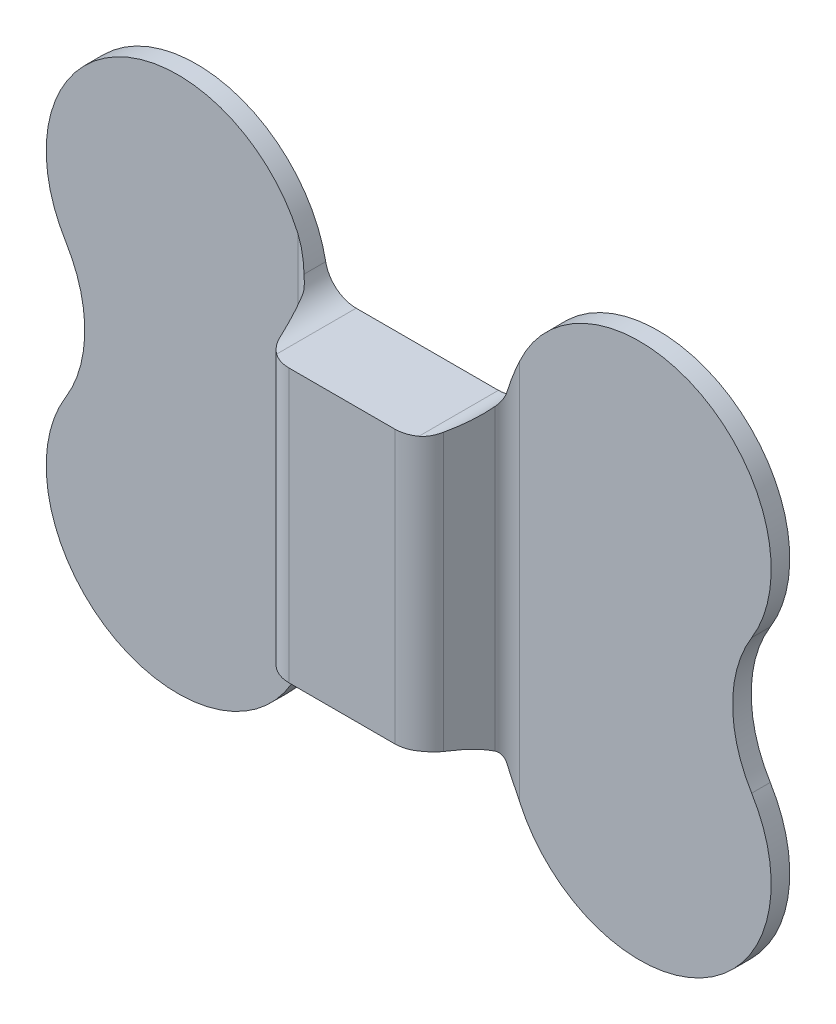
from build123d import *

# Parameters (mm, degrees)
BOSS_EXTRUDE1_DEPTH     = 27.56
CUT_EXTRUDE1_DEPTH      = 149.090525018
CUT_EXTRUDE1_DEPTH_BACK = 149.090525018


with BuildPart() as part:
    # Sketch1 → Boss-Extrude1 (new body)
    with BuildSketch(Plane.XY):
        with BuildLine():
            Line((22.96117968, 44), (-22.96117968, 44))
            ThreePointArc((-22.96117968, 44), (-29.323269783, 46.284832502), (-32.778097836, 52.095238095))
            ThreePointArc((-32.778097836, 52.095238095), (-89.927364847, 83.601091069), (-110.70300535, 21.738095238))
            ThreePointArc((-110.70300535, 21.738095238), (-104.55417528, 0), (-110.70300535, -21.738095238))
            ThreePointArc((-110.70300535, -21.738095238), (-89.927364847, -83.601091069), (-32.778097836, -52.095238095))
            ThreePointArc((-32.778097836, -52.095238095), (-29.323269783, -46.284832502), (-22.96117968, -44))
            Line((-22.96117968, -44), (22.96117968, -44))
            ThreePointArc((22.96117968, -44), (29.323269783, -46.284832502), (32.778097836, -52.095238095))
            ThreePointArc((32.778097836, -52.095238095), (89.927364847, -83.601091069), (110.70300535, -21.738095238))
            ThreePointArc((110.70300535, -21.738095238), (104.55417528, 0), (110.70300535, 21.738095238))
            ThreePointArc((110.70300535, 21.738095238), (89.927364847, 83.601091069), (32.778097836, 52.095238095))
            ThreePointArc((32.778097836, 52.095238095), (29.323269783, 46.284832502), (22.96117968, 44))
        make_face()
    extrude(amount=BOSS_EXTRUDE1_DEPTH)

    # Sketch2 → Cut-Extrude1 (cut, two sides: drawn at the far end of the back side and taken through both)
    with BuildSketch(Plane(origin=(0, 0, 0), x_dir=(1, 0, 0), z_dir=(0, 1, 0)).offset(-CUT_EXTRUDE1_DEPTH_BACK)):
        with BuildLine():
            Line((117, -6), (35.767564174, -6))
            ThreePointArc((35.767564174, -6), (32.945610035, -6.872461407), (31.108474327, -9.185370066))
            Line((31.108474327, -9.185370066), (26.433179694, -21.189259868))
            ThreePointArc((26.433179694, -21.189259868), (22.758908279, -25.815077185), (17.115, -27.56))
            Line((17.115, -27.56), (117, -27.56))
            Line((117, -27.56), (117, -6))
        make_face()
        with BuildLine():
            Line((-117, -27.56), (-117, -6))
            Line((-117, -6), (-35.767564174, -6))
            ThreePointArc((-35.767564174, -6), (-32.945610035, -6.872461407), (-31.108474327, -9.185370066))
            Line((-31.108474327, -9.185370066), (-26.433179694, -21.189259868))
            ThreePointArc((-26.433179694, -21.189259868), (-22.758908279, -25.815077185), (-17.115, -27.56))
            Line((-17.115, -27.56), (-117, -27.56))
        make_face()
    extrude(amount=CUT_EXTRUDE1_DEPTH + CUT_EXTRUDE1_DEPTH_BACK, mode=Mode.SUBTRACT)


solid = part.part
